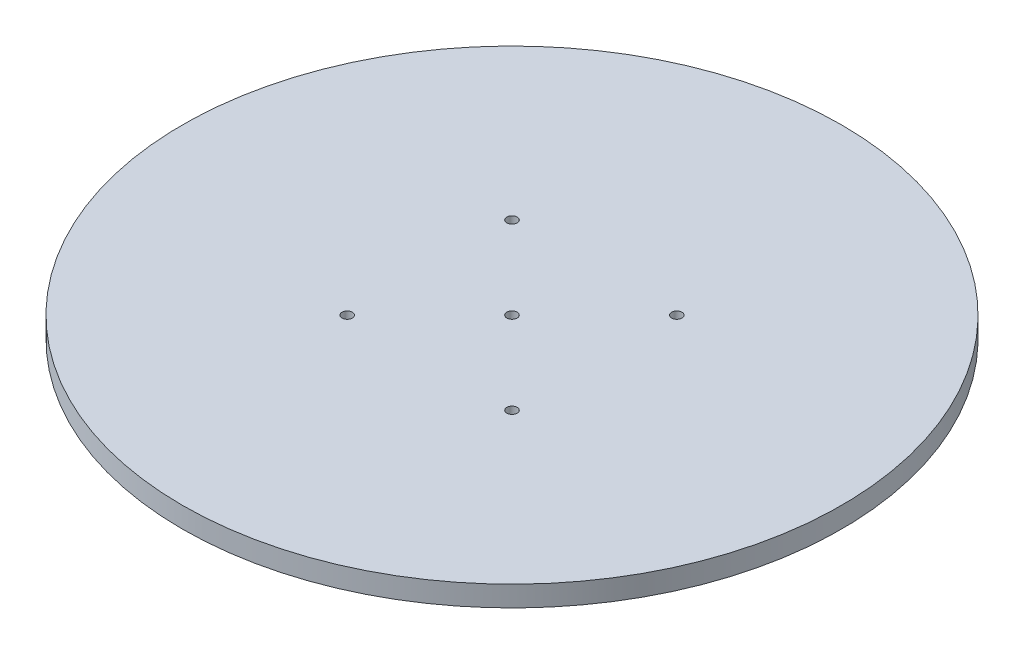
from build123d import *

# Parameters (mm, degrees)
SKETCH1_R                       = 127
BOSS_EXTRUDE1_DEPTH             = 7.9375
F_5_32_0_15625_DIAMETER_HOLE2_D = 3.96875


with BuildPart() as part:
    # Sketch1 → Boss-Extrude1 (new body)
    with BuildSketch(Plane(origin=(0, 0, 0), x_dir=(1, 0, 0), z_dir=(0, 1, 0))):
        with Locations(Location((0, 0, 0), (0, 0, 270))):
            Circle(SKETCH1_R)
    extrude(amount=BOSS_EXTRUDE1_DEPTH)

    # 5/32 (0.15625) Diameter Hole2 (through all)
    with Locations(Plane(origin=(0, 7.9375, 0), x_dir=(1, 0, 0), z_dir=(0, 1, 0))):
        with Locations((31.75, 31.75), (-31.75, -31.75), (-31.75, 31.75), (31.75, -31.75), (0, 0)):
            Hole(F_5_32_0_15625_DIAMETER_HOLE2_D / 2)


solid = part.part
